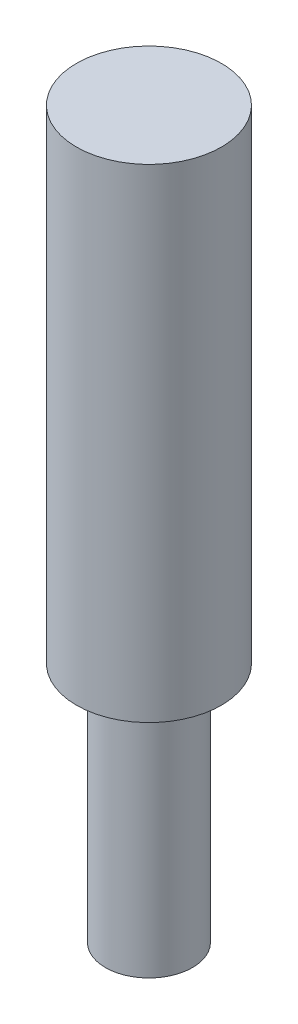
from build123d import *

# Parameters (mm, degrees)
SKETCH_1_R      = 0.9
EXTRUDE_1_DEPTH = 5
SKETCH_2_R      = 1.5
EXTRUDE_2_DEPTH = 10


with BuildPart() as part:
    # 草图1 → 凸台-拉伸1 (new body)
    with BuildSketch(Plane(origin=(0, 0, 0), x_dir=(1, 0, 0), z_dir=(0, 1, 0))):
        with Locations(Location((0, 0, 0), (0, 0, 270))):
            Circle(SKETCH_1_R)
    extrude(amount=EXTRUDE_1_DEPTH)

    # 草图2 → 凸台-拉伸2 (add)
    with BuildSketch(Plane(origin=(0, 5, 0), x_dir=(1, 0, 0), z_dir=(0, 1, 0))):
        with Locations(Location((0, 0, 0), (0, 0, 270))):
            Circle(SKETCH_2_R)
    extrude(amount=EXTRUDE_2_DEPTH)


solid = part.part
